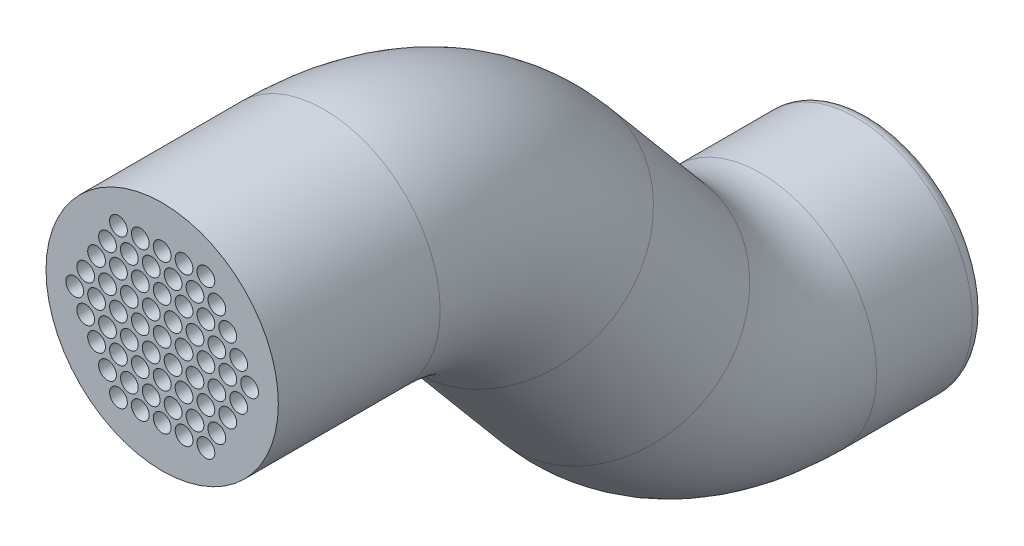
from build123d import *

# Parameters (mm, degrees)
SKETCH1_R   = 17
SKETCH1_R_2 = 1.3
FILLET1_R   = 2


with BuildPart() as part:
    # Sweep1: sweep along a path in Sketch2
    with BuildLine(Plane(origin=(0, 0, 0), x_dir=(0, 0, -1), z_dir=(1, 0, 0))) as sweep1_path:
        Line((0, 0), (23.679231965, 0))
        ThreePointArc((23.679231965, 0), (38.470871125, -3.279227454), (50.490787474, -12.502433661))
        Line((50.490787474, -12.502433661), (64.571881698, -29.283628291))
        ThreePointArc((64.571881698, -29.283628291), (74.87466714, -37.189233611), (87.553214992, -40))
        Line((87.553214992, -40), (103.563985247, -40))
    # Sketch1 → Sweep1 (sweep)
    with BuildSketch(Plane.XY):
        Circle(SKETCH1_R)
        with Locations((-6.4, 10.88)):
            Circle(SKETCH1_R_2, mode=Mode.SUBTRACT)
        with Locations((-3.2, 10.88)):
            Circle(SKETCH1_R_2, mode=Mode.SUBTRACT)
        with Locations((0, 10.88)):
            Circle(SKETCH1_R_2, mode=Mode.SUBTRACT)
        with Locations((3.2, 10.88)):
            Circle(SKETCH1_R_2, mode=Mode.SUBTRACT)
        with Locations((6.4, 10.88)):
            Circle(SKETCH1_R_2, mode=Mode.SUBTRACT)
        with Locations((-9.6, 5.44)):
            Circle(SKETCH1_R_2, mode=Mode.SUBTRACT)
        with Locations((-6.4, 5.44)):
            Circle(SKETCH1_R_2, mode=Mode.SUBTRACT)
        with Locations((-3.2, 5.44)):
            Circle(SKETCH1_R_2, mode=Mode.SUBTRACT)
        with Locations((0, 5.44)):
            Circle(SKETCH1_R_2, mode=Mode.SUBTRACT)
        with Locations((3.2, 5.44)):
            Circle(SKETCH1_R_2, mode=Mode.SUBTRACT)
        with Locations((6.4, 5.44)):
            Circle(SKETCH1_R_2, mode=Mode.SUBTRACT)
        with Locations((9.6, 5.44)):
            Circle(SKETCH1_R_2, mode=Mode.SUBTRACT)
        with Locations((-12.8, 0)):
            Circle(SKETCH1_R_2, mode=Mode.SUBTRACT)
        with Locations((-9.6, 0)):
            Circle(SKETCH1_R_2, mode=Mode.SUBTRACT)
        with Locations((-6.4, 0)):
            Circle(SKETCH1_R_2, mode=Mode.SUBTRACT)
        with Locations((-3.2, 0)):
            Circle(SKETCH1_R_2, mode=Mode.SUBTRACT)
        Circle(SKETCH1_R_2, mode=Mode.SUBTRACT)
        with Locations((3.2, 0)):
            Circle(SKETCH1_R_2, mode=Mode.SUBTRACT)
        with Locations((6.4, 0)):
            Circle(SKETCH1_R_2, mode=Mode.SUBTRACT)
        with Locations((9.6, 0)):
            Circle(SKETCH1_R_2, mode=Mode.SUBTRACT)
        with Locations((-9.6, -5.44)):
            Circle(SKETCH1_R_2, mode=Mode.SUBTRACT)
        with Locations((-6.4, -5.44)):
            Circle(SKETCH1_R_2, mode=Mode.SUBTRACT)
        with Locations((-3.2, -5.44)):
            Circle(SKETCH1_R_2, mode=Mode.SUBTRACT)
        with Locations((0, -5.44)):
            Circle(SKETCH1_R_2, mode=Mode.SUBTRACT)
        with Locations((3.2, -5.44)):
            Circle(SKETCH1_R_2, mode=Mode.SUBTRACT)
        with Locations((6.4, -5.44)):
            Circle(SKETCH1_R_2, mode=Mode.SUBTRACT)
        with Locations((9.6, -5.44)):
            Circle(SKETCH1_R_2, mode=Mode.SUBTRACT)
        with Locations((-8, 8.108718708)):
            Circle(SKETCH1_R_2, mode=Mode.SUBTRACT)
        with Locations((-4.8, 8.108718708)):
            Circle(SKETCH1_R_2, mode=Mode.SUBTRACT)
        with Locations((-1.6, 8.108718708)):
            Circle(SKETCH1_R_2, mode=Mode.SUBTRACT)
        with Locations((1.6, 8.108718708)):
            Circle(SKETCH1_R_2, mode=Mode.SUBTRACT)
        with Locations((4.8, 8.108718708)):
            Circle(SKETCH1_R_2, mode=Mode.SUBTRACT)
        with Locations((8, 8.108718708)):
            Circle(SKETCH1_R_2, mode=Mode.SUBTRACT)
        with Locations((-11.2, 2.668718708)):
            Circle(SKETCH1_R_2, mode=Mode.SUBTRACT)
        with Locations((-8, 2.668718708)):
            Circle(SKETCH1_R_2, mode=Mode.SUBTRACT)
        with Locations((-4.8, 2.668718708)):
            Circle(SKETCH1_R_2, mode=Mode.SUBTRACT)
        with Locations((-1.6, 2.668718708)):
            Circle(SKETCH1_R_2, mode=Mode.SUBTRACT)
        with Locations((1.6, 2.668718708)):
            Circle(SKETCH1_R_2, mode=Mode.SUBTRACT)
        with Locations((4.8, 2.668718708)):
            Circle(SKETCH1_R_2, mode=Mode.SUBTRACT)
        with Locations((8, 2.668718708)):
            Circle(SKETCH1_R_2, mode=Mode.SUBTRACT)
        with Locations((-11.2, -2.771281292)):
            Circle(SKETCH1_R_2, mode=Mode.SUBTRACT)
        with Locations((-8, -2.771281292)):
            Circle(SKETCH1_R_2, mode=Mode.SUBTRACT)
        with Locations((-4.8, -2.771281292)):
            Circle(SKETCH1_R_2, mode=Mode.SUBTRACT)
        with Locations((-1.6, -2.771281292)):
            Circle(SKETCH1_R_2, mode=Mode.SUBTRACT)
        with Locations((1.6, -2.771281292)):
            Circle(SKETCH1_R_2, mode=Mode.SUBTRACT)
        with Locations((4.8, -2.771281292)):
            Circle(SKETCH1_R_2, mode=Mode.SUBTRACT)
        with Locations((8, -2.771281292)):
            Circle(SKETCH1_R_2, mode=Mode.SUBTRACT)
        with Locations((-8, -8.211281292)):
            Circle(SKETCH1_R_2, mode=Mode.SUBTRACT)
        with Locations((-4.8, -8.211281292)):
            Circle(SKETCH1_R_2, mode=Mode.SUBTRACT)
        with Locations((-1.6, -8.211281292)):
            Circle(SKETCH1_R_2, mode=Mode.SUBTRACT)
        with Locations((1.6, -8.211281292)):
            Circle(SKETCH1_R_2, mode=Mode.SUBTRACT)
        with Locations((4.8, -8.211281292)):
            Circle(SKETCH1_R_2, mode=Mode.SUBTRACT)
        with Locations((8, -8.211281292)):
            Circle(SKETCH1_R_2, mode=Mode.SUBTRACT)
        with Locations((12.8, 0)):
            Circle(SKETCH1_R_2, mode=Mode.SUBTRACT)
        with Locations((11.2, 2.668718708)):
            Circle(SKETCH1_R_2, mode=Mode.SUBTRACT)
        with Locations((11.2, -2.771281292)):
            Circle(SKETCH1_R_2, mode=Mode.SUBTRACT)
        with Locations((-6.4, -10.88)):
            Circle(SKETCH1_R_2, mode=Mode.SUBTRACT)
        with Locations((-3.2, -10.88)):
            Circle(SKETCH1_R_2, mode=Mode.SUBTRACT)
        with Locations((0, -10.88)):
            Circle(SKETCH1_R_2, mode=Mode.SUBTRACT)
        with Locations((3.2, -10.88)):
            Circle(SKETCH1_R_2, mode=Mode.SUBTRACT)
        with Locations((6.4, -10.88)):
            Circle(SKETCH1_R_2, mode=Mode.SUBTRACT)
    sweep(path=sweep1_path.line)

    # Fillet1
    fillet1_edges = [part.edges().sort_by_distance(p)[0] for p in [
        (-17, -40, -103.563985247),
    ]]
    fillet(fillet1_edges, radius=FILLET1_R)


solid = part.part
